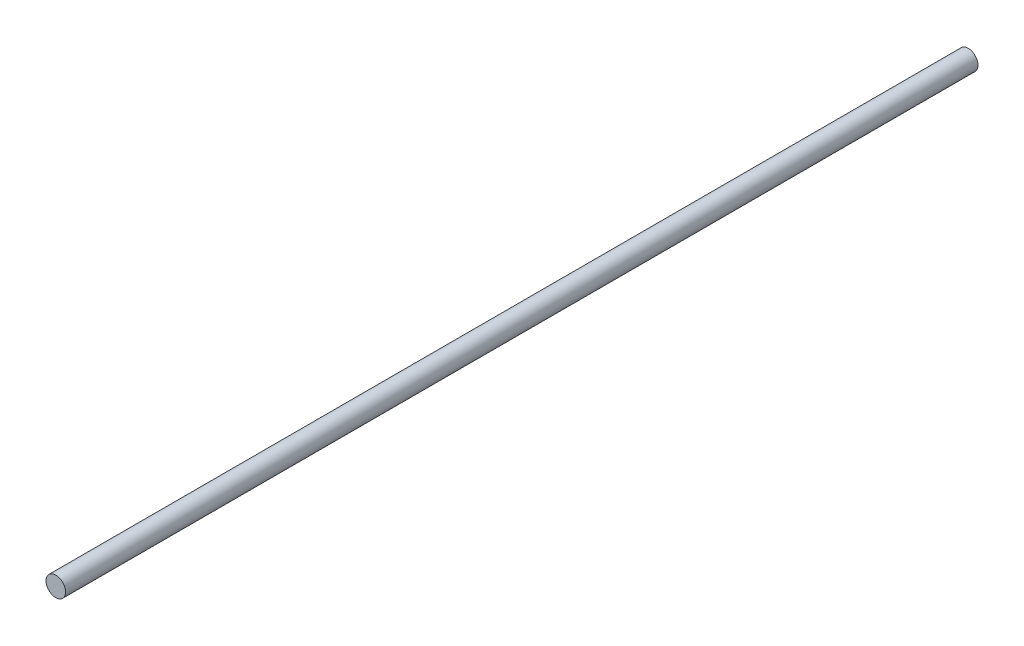
from build123d import *

# Parameters (mm, degrees)
SKETCH1_R           = 7.5
BOSS_EXTRUDE1_DEPTH = 700


with BuildPart() as part:
    # Sketch1 → Boss-Extrude1 (new body)
    with BuildSketch(Plane.XY):
        Circle(SKETCH1_R)
    extrude(amount=BOSS_EXTRUDE1_DEPTH)


solid = part.part
